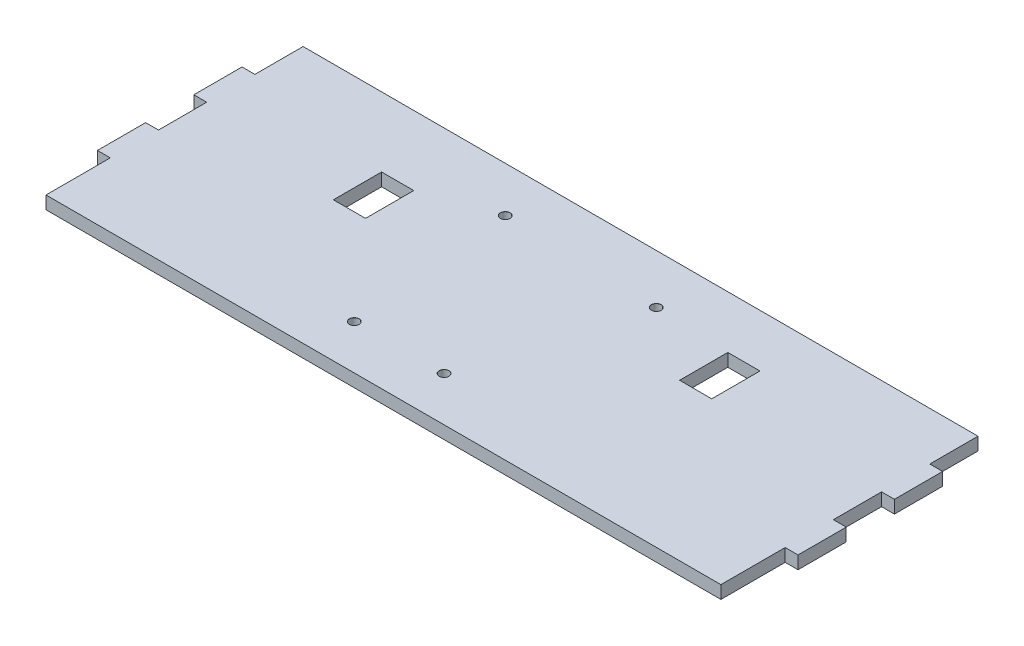
from build123d import *

# Parameters (mm, degrees)
SKETCH1_W                       = 210
SKETCH1_H                       = 80
BOSS_EXTRUDE1_DEPTH             = 4
SKETCH2_W                       = 10
SKETCH2_H                       = 15
CUT_EXTRUDE1_DEPTH              = 225.757647256
SKETCH3_W                       = 15
SKETCH3_H                       = 4
BOSS_EXTRUDE2_DEPTH             = 4
SKETCH4_W                       = 15
SKETCH4_H                       = 4
BOSS_EXTRUDE3_DEPTH             = 4
F_3_0MM_DOWEL_HOLE1_D           = 3
F_3_0MM_DOWEL_HOLE1_CSINK_D     = 3.05
F_3_0MM_DOWEL_HOLE1_CSINK_ANGLE = 90


with BuildPart() as part:
    # Sketch1 → Boss-Extrude1 (new body)
    with BuildSketch(Plane(origin=(0, 0, 0), x_dir=(1, 0, 0), z_dir=(0, 1, 0))):
        with Locations((105, 40)):
            Rectangle(SKETCH1_W, SKETCH1_H)
    extrude(amount=BOSS_EXTRUDE1_DEPTH)

    # Sketch2 → Cut-Extrude1 (cut, through all)
    with BuildSketch(Plane(origin=(0, 4, 0), x_dir=(1, 0, 0), z_dir=(0, 1, 0))):
        with Locations((153.509116539, 56.141774946)):
            Rectangle(SKETCH2_W, SKETCH2_H)
        with Locations((51.014837185, 50.904860517)):
            Rectangle(SKETCH2_W, SKETCH2_H)
    extrude(amount=-CUT_EXTRUDE1_DEPTH, mode=Mode.SUBTRACT)

    # Sketch3 → Boss-Extrude2 (add)
    with BuildSketch(Plane.ZY):
        with Locations((-57.5, 2)):
            Rectangle(SKETCH3_W, SKETCH3_H)
        with Locations((-27.5, 2)):
            Rectangle(SKETCH3_W, SKETCH3_H)
    extrude(amount=BOSS_EXTRUDE2_DEPTH)

    # Sketch4 → Boss-Extrude3 (add)
    with BuildSketch(Plane(origin=(210, 0, 0), x_dir=(0, 0, -1), z_dir=(1, 0, 0))):
        with Locations((57.5, 2)):
            Rectangle(SKETCH4_W, SKETCH4_H)
        with Locations((27.5, 2)):
            Rectangle(SKETCH4_W, SKETCH4_H)
    extrude(amount=BOSS_EXTRUDE3_DEPTH)

    # Ø3.0mm Dowel Hole1 (through all)
    with Locations(Plane(origin=(0, 4, 0), x_dir=(1, 0, 0), z_dir=(0, 1, 0))):
        with Locations((125.265241585, 64.631998291), (77.005241585, 65.901998291), (82.085241585, 13.831998291), (110.025241585, 13.831998291)):
            CounterSinkHole(F_3_0MM_DOWEL_HOLE1_D / 2, F_3_0MM_DOWEL_HOLE1_CSINK_D / 2, counter_sink_angle=F_3_0MM_DOWEL_HOLE1_CSINK_ANGLE)


solid = part.part
